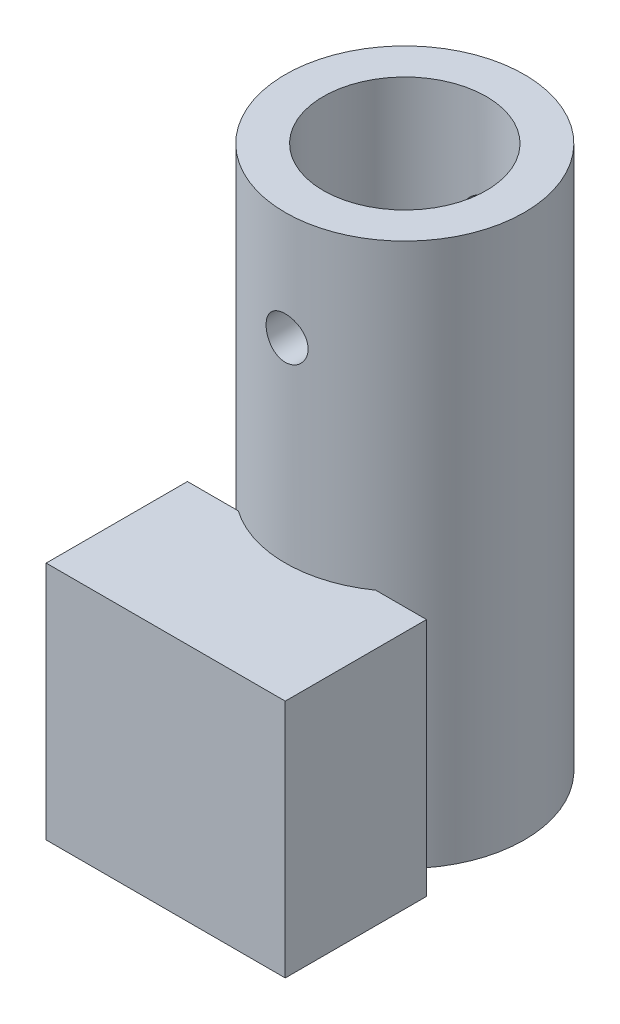
from build123d import *

# Parameters (mm, degrees)
SKETCH_1_R           = 11
EXTRUDE_1_DEPTH      = 50
SKETCH_2_R           = 7.5
CUT_EXTRUDE_1_DEPTH  = 53.364109846
SKETCH_4_R           = 1.935
CUT_EXTRUDE_4_DEPTH  = 50
EXTRUDE_3_DEPTH      = 10
EXTRUDE_3_DEPTH_BACK = 3
SKETCH_11_W          = 22
SKETCH_11_H          = 22.065


with BuildPart() as part:
    # 草圖1 → 填料-伸長1 (new body)
    with BuildSketch(Plane(origin=(0, 0, 0), x_dir=(1, 0, 0), z_dir=(0, 1, 0))):
        with Locations(Location((0, 0, 0), (0, 0, 270))):
            Circle(SKETCH_1_R)
    extrude(amount=EXTRUDE_1_DEPTH)

    # 草圖2 → 除料-伸長1 (cut, through all)
    with BuildSketch(Plane(origin=(0, 50, 0), x_dir=(1, 0, 0), z_dir=(0, 1, 0))):
        with Locations(Location((0, 0, 0), (0, 0, 270))):
            Circle(SKETCH_2_R)
    extrude(amount=-CUT_EXTRUDE_1_DEPTH, mode=Mode.SUBTRACT)

    # 草圖4 → 除料-伸長4 (cut)
    with BuildSketch(Plane.XY.offset(12)):
        with Locations((0, 40)):
            Circle(SKETCH_4_R)
    extrude(amount=-CUT_EXTRUDE_4_DEPTH, mode=Mode.SUBTRACT)

    # 草圖11 → 填料-伸長3 (add, two sides: drawn at the far end of the back side and taken through both)
    with BuildSketch(Plane.XY.offset(12).offset(-EXTRUDE_3_DEPTH_BACK)):
        with Locations((0, 11.0325)):
            Rectangle(SKETCH_11_W, SKETCH_11_H)
    extrude(amount=EXTRUDE_3_DEPTH + EXTRUDE_3_DEPTH_BACK)


solid = part.part
